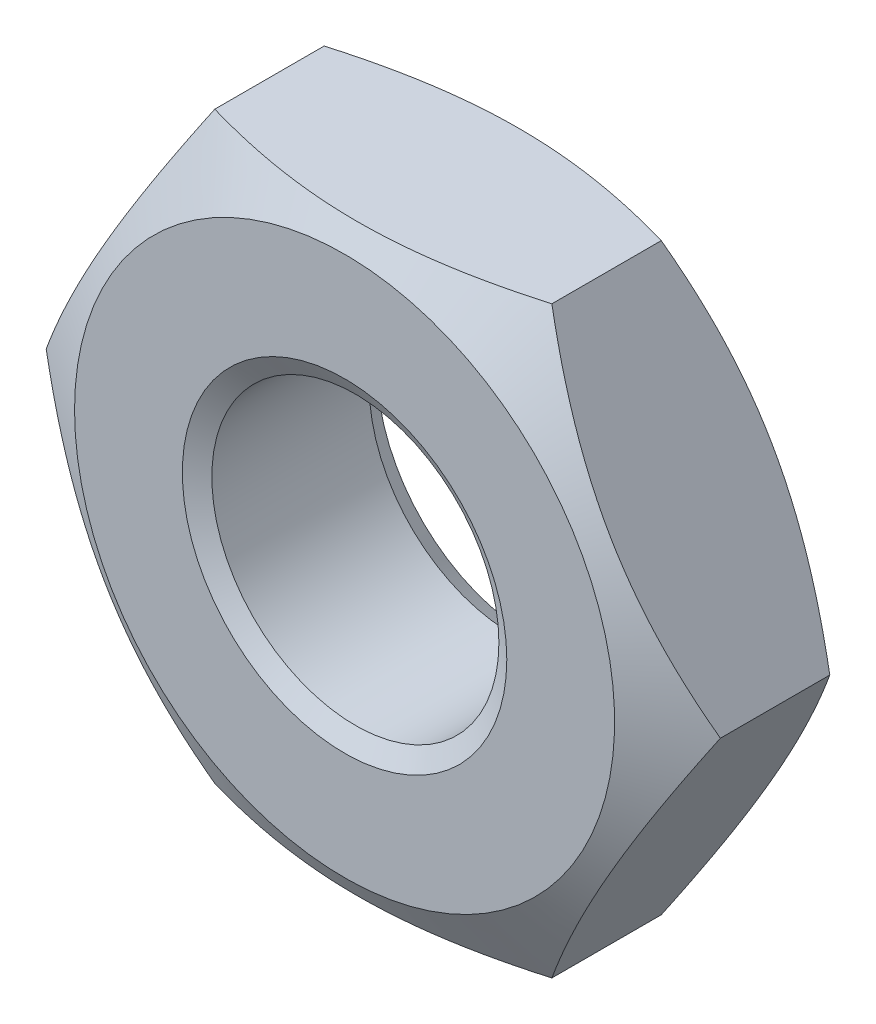
from build123d import *
from OCP.BRepFilletAPI import BRepFilletAPI_MakeChamfer

# Parameters (mm, degrees)
SKETCH1_R        = 2.4585
BASENUT_DEPTH    = 3.2
ENDCHAMFER_SIZE  = 0.32
ENDCHAMFER_SIZE2 = 0.184752086


with BuildPart() as part:
    # Sketch1 → BaseNut (new body)
    with BuildSketch(Plane.XY):
        Polygon((2.886751346, -5), (5.773502692, 0), (2.886751346, 5), (-2.886751346, 5), (-5.773502692, 0), (-2.886751346, -5), align=None)
        Circle(SKETCH1_R, mode=Mode.SUBTRACT)
    extrude(amount=-BASENUT_DEPTH)

    # Sketch2 → Double-Chamfer (revolve, cut)
    with BuildSketch(Plane(origin=(0, 0, 0), x_dir=(1, 0, 0), z_dir=(0, 1, 0))):
        Polygon((-5.773502692, 3.2), (-4.625, 3.2), (-5.773502692, 2.536911662), align=None)
        Polygon((-5.773502692, 0.663088338), (-5.773502692, 0), (-4.625, 0), align=None)
    revolve(axis=Axis((0, 0, -3.375940562), (0, 0, 1)), mode=Mode.SUBTRACT)

    # EndChamfer: one chamfer whose edges measure the first distance from different faces: ONE call of the kernel's chamfer builder (chamfer() names one face for all edges)
    endchamfer_edges_1 = [part.edges().sort_by_distance(p)[0] for p in [
        (-2.4585, 0, -3.2),
    ]]
    endchamfer_side_1 = [part.faces().sort_by_distance(p)[0] for p in [
        (-2.4585, 0, -1.6),
    ]]
    endchamfer_edges_2 = [part.edges().sort_by_distance(p)[0] for p in [
        (-2.4585, 0, 0),
    ]]
    endchamfer_side_2 = [part.faces().sort_by_distance(p)[0] for p in [
        (4.494185245, 0, 0),
    ]]
    endchamfer = BRepFilletAPI_MakeChamfer(part.part.solid().wrapped)
    for e in endchamfer_edges_1:
        endchamfer.Add(ENDCHAMFER_SIZE, ENDCHAMFER_SIZE2, e.wrapped, endchamfer_side_1[0].wrapped)  # the first distance lies on this face
    for e in endchamfer_edges_2:
        endchamfer.Add(ENDCHAMFER_SIZE, ENDCHAMFER_SIZE2, e.wrapped, endchamfer_side_2[0].wrapped)  # the first distance lies on this face
    add(Compound.cast(endchamfer.Shape()), mode=Mode.REPLACE)


solid = part.part
